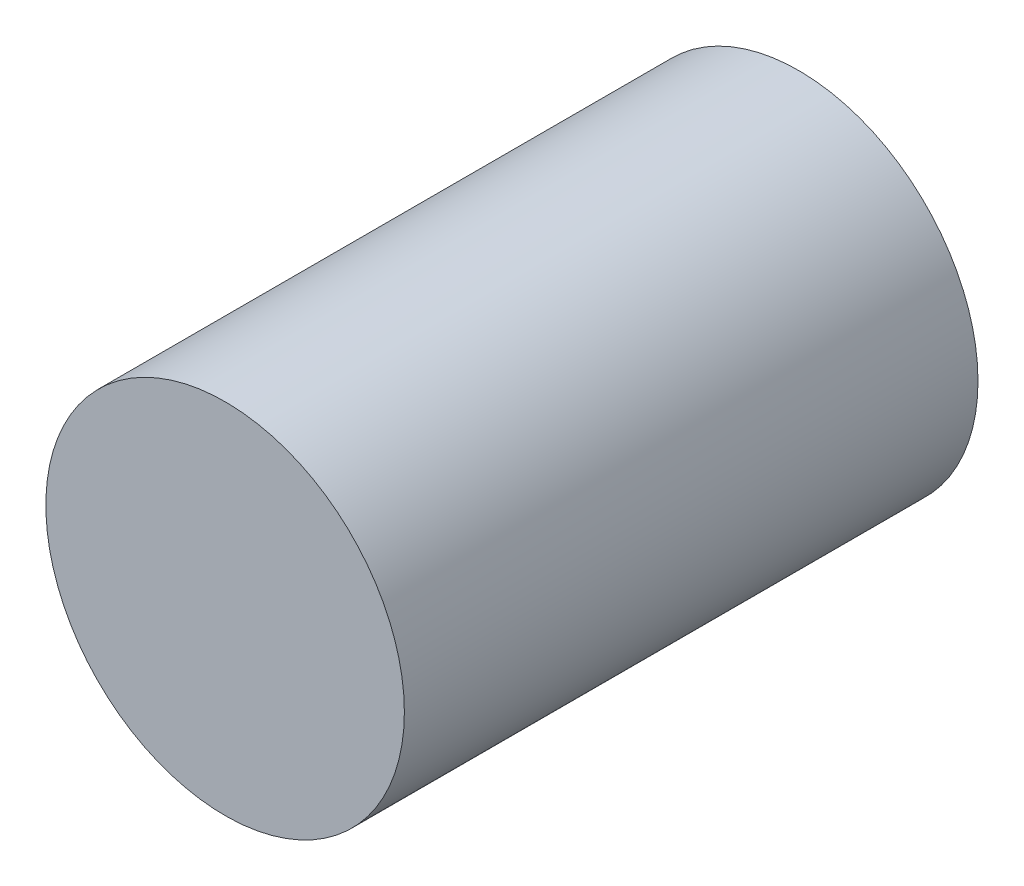
from build123d import *

# Parameters (mm, degrees)
ESQUISSE1_R        = 2.5
BOSS_EXTRU_1_DEPTH = 8


with BuildPart() as part:
    # Esquisse1 → Boss.-Extru.1 (new body)
    with BuildSketch(Plane.XY):
        Circle(ESQUISSE1_R)
    extrude(amount=BOSS_EXTRU_1_DEPTH)


solid = part.part
